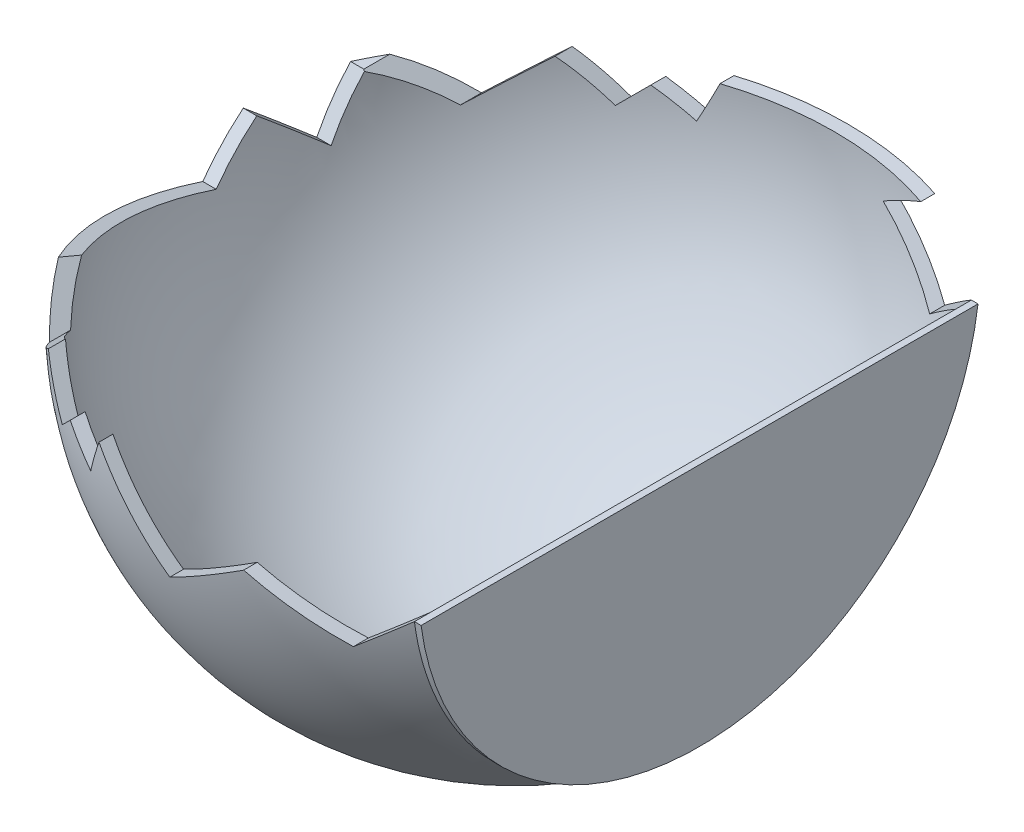
from build123d import *

# Parameters (mm, degrees)
REVOLVE7_ANGLE          = 180
SHELL1_T                = -2
CUT_EXTRUDE1_DEPTH      = 10
CUT_EXTRUDE2_DEPTH      = 123.474487139
CUT_EXTRUDE2_DEPTH_BACK = 123.474487139
CUT_EXTRUDE3_DEPTH      = 123.474487139
CUT_EXTRUDE3_DEPTH_BACK = 123.474487139
CUT_EXTRUDE10_DEPTH     = 150
BOSS_EXTRUDE1_DEPTH     = 1


with BuildPart() as part:
    # Sketch3 → Revolve7 (revolve)
    with BuildSketch(Plane(origin=(0, 0, 0), x_dir=(1, 0, 0), z_dir=(0, 1, 0))):
        with BuildLine():
            Line((0, 50), (0, -50))
            ThreePointArc((0, -50), (-50, 0), (0, 50))
        make_face()
    revolve(axis=Axis((0, 0, -50), (0, 0, 1)), revolution_arc=REVOLVE7_ANGLE)

    # Shell1
    shell1_openings = [part.faces().sort_by_distance(p)[0] for p in [
        (0, 0, 0),
    ]]
    offset(amount=SHELL1_T, openings=shell1_openings)

    # Sketch7 → Cut-Extrude1 (cut)
    with BuildSketch(Plane.XY.offset(50)):
        Polygon((-14.826397907, 0), (-3.370798864, -11.455599042), (15.645535913, 0), align=None)
    extrude(amount=-CUT_EXTRUDE1_DEPTH, mode=Mode.SUBTRACT)

    # Sketch9 → Cut-Extrude2 (cut, two sides: drawn at the far end of the back side and taken through both)
    with BuildSketch(Plane.XY.offset(50).offset(-CUT_EXTRUDE2_DEPTH_BACK)):
        Polygon((8.292044244, -4.429804855), (20.150794945, -10.787955598), (33.666572042, 0), (15.645535913, 0), align=None)
    extrude(amount=CUT_EXTRUDE2_DEPTH + CUT_EXTRUDE2_DEPTH_BACK, mode=Mode.SUBTRACT)

    # Sketch10 → Cut-Extrude3 (cut, two sides: drawn at the far end of the back side and taken through both)
    with BuildSketch(Plane.XY.offset(50).offset(-CUT_EXTRUDE3_DEPTH_BACK)):
        Polygon((-30.799589022, 0), (-43.496228113, 0), (-37.52885371, -5.967374403), align=None)
        Polygon((-14.826397907, 0), (-30.799589022, 0), (-25.323697422, -5.475891599), (-22.116726159, -2.268920336), (-17.177232044, -5.475891599), align=None)
    extrude(amount=CUT_EXTRUDE3_DEPTH + CUT_EXTRUDE3_DEPTH_BACK, mode=Mode.SUBTRACT)

    # Sketch12 → Cut-Extrude10 (cut)
    with BuildSketch(Plane(origin=(50, 0, 0), x_dir=(0, 0, -1), z_dir=(1, 0, 0))):
        Polygon((16.603317185, -8.277154343), (20.753512458, 0), (-28.80470168, 0), (2.281074676, -8.277154343), (8.384303018, -1.767044111), align=None)
    extrude(amount=-CUT_EXTRUDE10_DEPTH, mode=Mode.SUBTRACT)

    # Split1
    split(bisect_by=Plane(origin=(26.748894099, 0, 0), x_dir=(0, 0, 1), z_dir=(1, 0, 0)), keep=Keep.BOTTOM)

    # Sketch15 → Boss-Extrude1 (add)
    with BuildSketch(Plane(origin=(26.748894099, 0, 0), x_dir=(0, 0, -1), z_dir=(1, 0, 0))):
        with BuildLine():
            Line((-41.880896681, -5.521517702), (41.880896681, -5.521517702))
            ThreePointArc((41.880896681, -5.521517702), (0, -42.243303191), (-41.880896681, -5.521517702))
        make_face()
    extrude(amount=BOSS_EXTRUDE1_DEPTH)


solid = part.part
